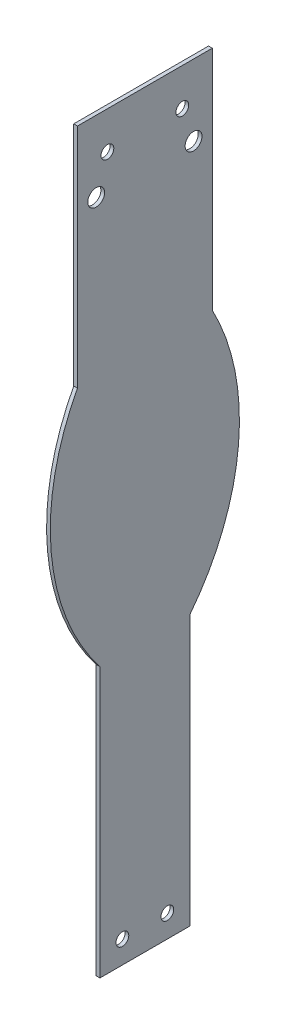
from build123d import *

# Parameters (mm, degrees)
BOSS_EXTRUDE1_DEPTH  = 1
M4_CLEARANCE_HOLE1_D = 4.5
M3_CLEARANCE_HOLE1_D = 3.4
M3_CLEARANCE_HOLE2_D = 3.4


with BuildPart() as part:
    # Sketch1 → Boss-Extrude1 (new body)
    with BuildSketch(Plane(origin=(0, 0, 0), x_dir=(0, 0, -1), z_dir=(1, 0, 0))):
        with BuildLine():
            Line((12, -200), (12, -128))
            ThreePointArc((12, -128), (25, -95.198992339), (18, -60.617116977))
            Line((18, -60.617116977), (18, 0))
            Line((18, 0), (-18, 0))
            Line((-18, 0), (-18, -60.617116977))
            ThreePointArc((-18, -60.617116977), (-25, -95.198992339), (-12, -128))
            Line((-12, -128), (-12, -200))
            Line((-12, -200), (12, -200))
        make_face()
    extrude(amount=BOSS_EXTRUDE1_DEPTH)

    # M4 Clearance Hole1 (through all)
    with Locations(Plane.ZY):
        with Locations((13, -19), (-13, -19)):
            Hole(M4_CLEARANCE_HOLE1_D / 2)

    # M3 Clearance Hole1 (through all)
    with Locations(Plane.ZY):
        with Locations((-10, -10), (10, -10)):
            Hole(M3_CLEARANCE_HOLE1_D / 2)

    # M3 Clearance Hole2 (through all)
    with Locations(Plane.ZY):
        with Locations((6, -194), (-6, -194)):
            Hole(M3_CLEARANCE_HOLE2_D / 2)


solid = part.part
